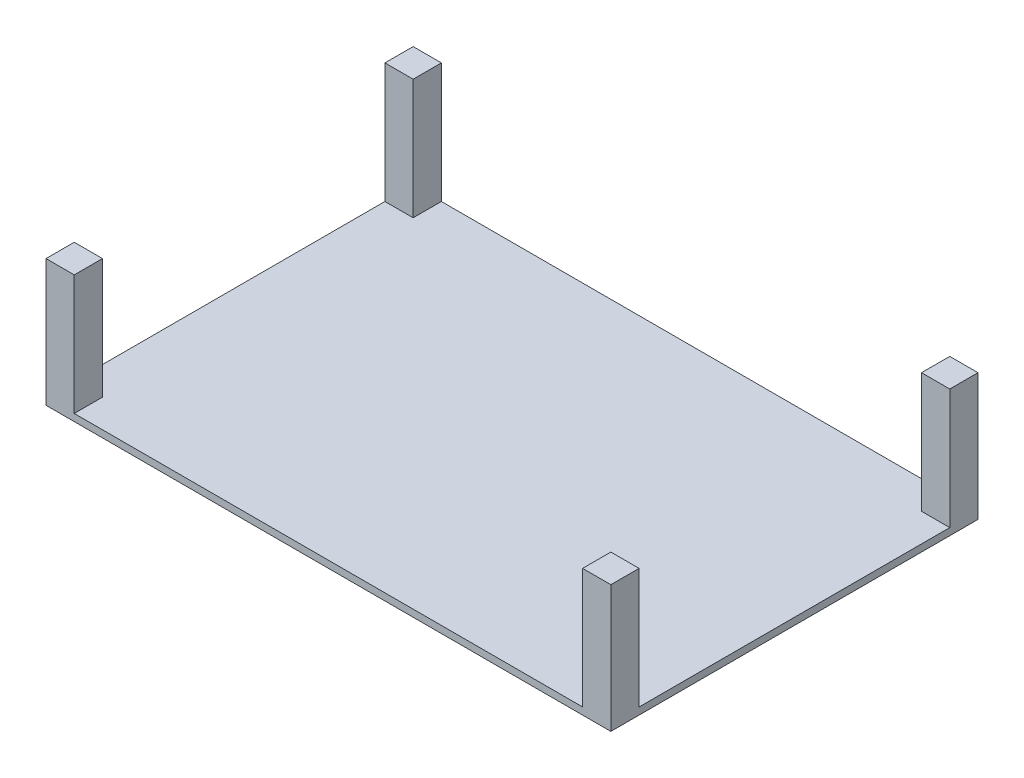
from build123d import *

# Parameters (mm, degrees)
SKETCH2_W            = 254
SKETCH2_H            = 165.1
BOSS_EXTRUDE1_DEPTH  = 3.175
SKETCH3_W            = 12.7
SKETCH3_H            = 12.7
BOSS_EXTRUDE2_DEPTH  = 53.975
LPATTERN1_COUNT      = 2
LPATTERN1_PITCH      = 152.4
LPATTERN1_COUNT_DIR2 = 2
LPATTERN1_PITCH_DIR2 = 241.3


with BuildPart() as part:
    # Sketch2 → Boss-Extrude1 (new body)
    with BuildSketch(Plane(origin=(0, 0, 0), x_dir=(1, 0, 0), z_dir=(0, 1, 0))):
        Rectangle(SKETCH2_W, SKETCH2_H)
    extrude(amount=BOSS_EXTRUDE1_DEPTH)

    # Sketch3 → Boss-Extrude2 (add)
    with BuildSketch(Plane(origin=(0, 3.175, 0), x_dir=(1, 0, 0), z_dir=(0, 1, 0))):
        with Locations((-120.65, -76.2)):
            Rectangle(SKETCH3_W, SKETCH3_H)
    boss_extrude2 = extrude(amount=BOSS_EXTRUDE2_DEPTH)

    # LPattern1: Boss-Extrude2 2 × 2
    with Locations(*[(j * LPATTERN1_PITCH_DIR2, 0, -i * LPATTERN1_PITCH) for i in range(LPATTERN1_COUNT) for j in range(LPATTERN1_COUNT_DIR2) if (i, j) != (0, 0)]):
        add(boss_extrude2)


solid = part.part
